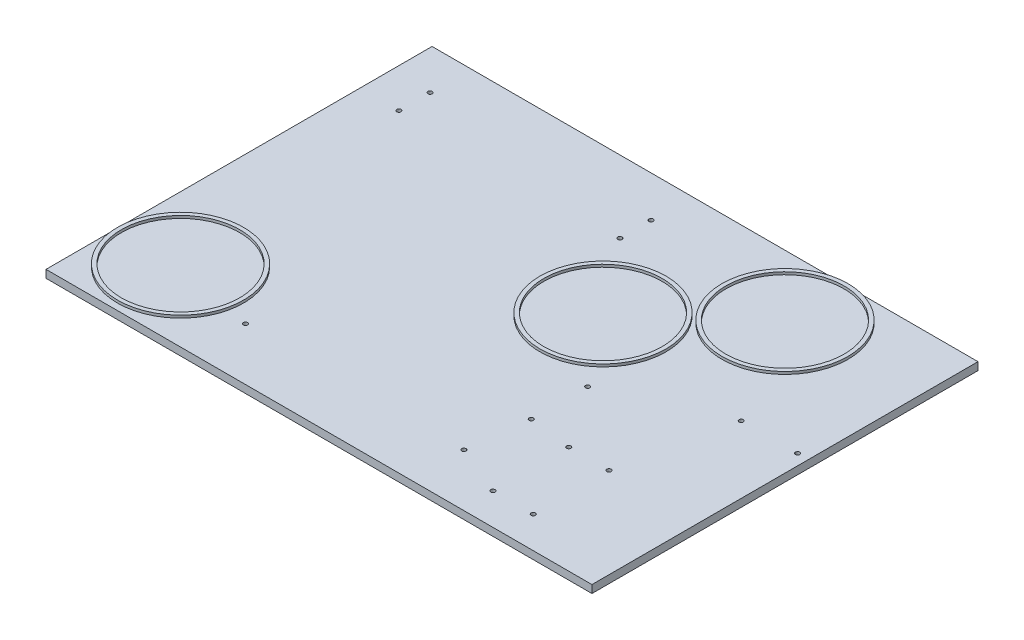
from build123d import *

# Parameters (mm, degrees)
SKETCH1_W                  = 420
SKETCH1_H                  = 297
PLATE_DEPTH                = 6
TAPPED_HOLES_M4_DEPTH      = 258.270771756
TAPPED_HOLES_M4_DEPTH_BACK = 258.270771756
SKETCH2_R                  = 1.65
JAR_LOCATING_RINGS_START   = 6
SKETCH3_R                  = 48.5
SKETCH3_R_2                = 45.5
JAR_LOCATING_RINGS_DEPTH   = 2


with BuildPart() as part:
    # Sketch1 → Plate (new body)
    with BuildSketch(Plane(origin=(0, 0, 0), x_dir=(1, 0, 0), z_dir=(0, 1, 0))):
        Rectangle(SKETCH1_W, SKETCH1_H)
    extrude(amount=PLATE_DEPTH)

    # Sketch2 → Tapped_Holes_M4 (cut, two sides: drawn at the far end of the back side and taken through both)
    with BuildSketch(Plane(origin=(0, 0, 0), x_dir=(1, 0, 0), z_dir=(0, 1, 0)).offset(-TAPPED_HOLES_M4_DEPTH_BACK)):
        with Locations(Location((-97, -108, 0), (0, 0, 270))):
            Circle(SKETCH2_R)
        with Locations(Location((71, -108, 0), (0, 0, 270))):
            Circle(SKETCH2_R)
        with Locations(Location((-180, 117, 0), (0, 0, 270))):
            Circle(SKETCH2_R)
        with Locations(Location((-180, 93, 0), (0, 0, 270))):
            Circle(SKETCH2_R)
        with Locations(Location((-10, 117, 0), (0, 0, 270))):
            Circle(SKETCH2_R)
        with Locations(Location((-10, 93, 0), (0, 0, 270))):
            Circle(SKETCH2_R)
        with Locations(Location((109.5, -65.85, 0), (0, 0, 270))):
            Circle(SKETCH2_R)
        with Locations(Location((109.5, -124.15, 0), (0, 0, 270))):
            Circle(SKETCH2_R)
        with Locations(Location((140.5, -65.85, 0), (0, 0, 270))):
            Circle(SKETCH2_R)
        with Locations(Location((140.5, -124.15, 0), (0, 0, 270))):
            Circle(SKETCH2_R)
        with Locations(Location((158.3225, 18, 0), (0, 0, 270))):
            Circle(SKETCH2_R)
        with Locations(Location((201.6775, 18, 0), (0, 0, 270))):
            Circle(SKETCH2_R)
        with Locations(Location((76.5, -18.3225, 0), (0, 0, 270))):
            Circle(SKETCH2_R)
        with Locations(Location((76.5, -61.6775, 0), (0, 0, 270))):
            Circle(SKETCH2_R)
    extrude(amount=TAPPED_HOLES_M4_DEPTH + TAPPED_HOLES_M4_DEPTH_BACK, mode=Mode.SUBTRACT)

    # Sketch3 → Jar_Locating_Rings (add)
    # profile 1 of 3: a face of its own
    with BuildSketch(Plane(origin=(0, 0, 0), x_dir=(1, 0, 0), z_dir=(0, 1, 0)).offset(JAR_LOCATING_RINGS_START)):
        with Locations(Location((-160, -95, 0), (0, 0, 270))):
            Circle(SKETCH3_R)
        with Locations(Location((-160, -95, 0), (0, 0, 270))):
            Circle(SKETCH3_R_2, mode=Mode.SUBTRACT)
    # profile 2 of 3: a face of its own
    with BuildSketch(Plane(origin=(0, 0, 0), x_dir=(1, 0, 0), z_dir=(0, 1, 0)).offset(JAR_LOCATING_RINGS_START)):
        with Locations(Location((35, 35, 0), (0, 0, 90))):
            Circle(SKETCH3_R)
        with Locations(Location((35, 35, 0), (0, 0, 270))):
            Circle(SKETCH3_R_2, mode=Mode.SUBTRACT)
    # profile 3 of 3: a face of its own
    with BuildSketch(Plane(origin=(0, 0, 0), x_dir=(1, 0, 0), z_dir=(0, 1, 0)).offset(JAR_LOCATING_RINGS_START)):
        with Locations(Location((110, 100, 0), (0, 0, 90))):
            Circle(SKETCH3_R)
        with Locations(Location((110, 100, 0), (0, 0, 270))):
            Circle(SKETCH3_R_2, mode=Mode.SUBTRACT)
    extrude(amount=JAR_LOCATING_RINGS_DEPTH)


solid = part.part
